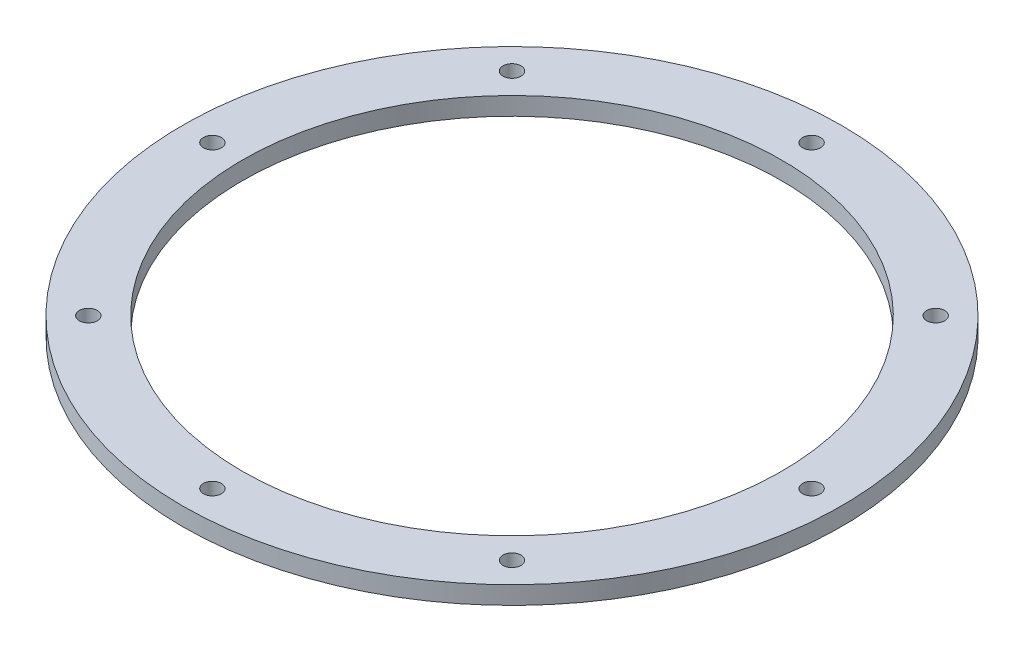
from build123d import *

# Parameters (mm, degrees)
SKETCH1_R           = 55
SKETCH1_R_2         = 45
BOSS_EXTRUDE1_DEPTH = 3
SKETCH3_R           = 1.5
CUT_EXTRUDE1_DEPTH  = 3
CRVPATTERN1_COUNT   = 8


with BuildPart() as part:
    # Sketch1 → Boss-Extrude1 (new body)
    with BuildSketch(Plane(origin=(0, 0, 0), x_dir=(1, 0, 0), z_dir=(0, 1, 0))):
        with Locations(Location((0, 0, 0), (0, 0, 270))):
            Circle(SKETCH1_R)
        with Locations(Location((0, 0, 0), (0, 0, 270))):
            Circle(SKETCH1_R_2, mode=Mode.SUBTRACT)
    extrude(amount=BOSS_EXTRUDE1_DEPTH)

    # Sketch3 → Cut-Extrude1 (cut)
    with BuildSketch(Plane(origin=(0, 3, 0), x_dir=(1, 0, 0), z_dir=(0, 1, 0))):
        with Locations(Location((0, 50, 0), (0, 0, 270))):
            Circle(SKETCH3_R)
    cut_extrude1 = extrude(amount=-CUT_EXTRUDE1_DEPTH, mode=Mode.SUBTRACT)

    # CrvPattern1: Cut-Extrude1 ×8 about axis
    crvpattern1_axis = Axis((0, 3, 0), (0, 1, 0))
    for i in range(1, CRVPATTERN1_COUNT):
        add(cut_extrude1.rotate(crvpattern1_axis, i * 360 / CRVPATTERN1_COUNT), mode=Mode.SUBTRACT)


solid = part.part
